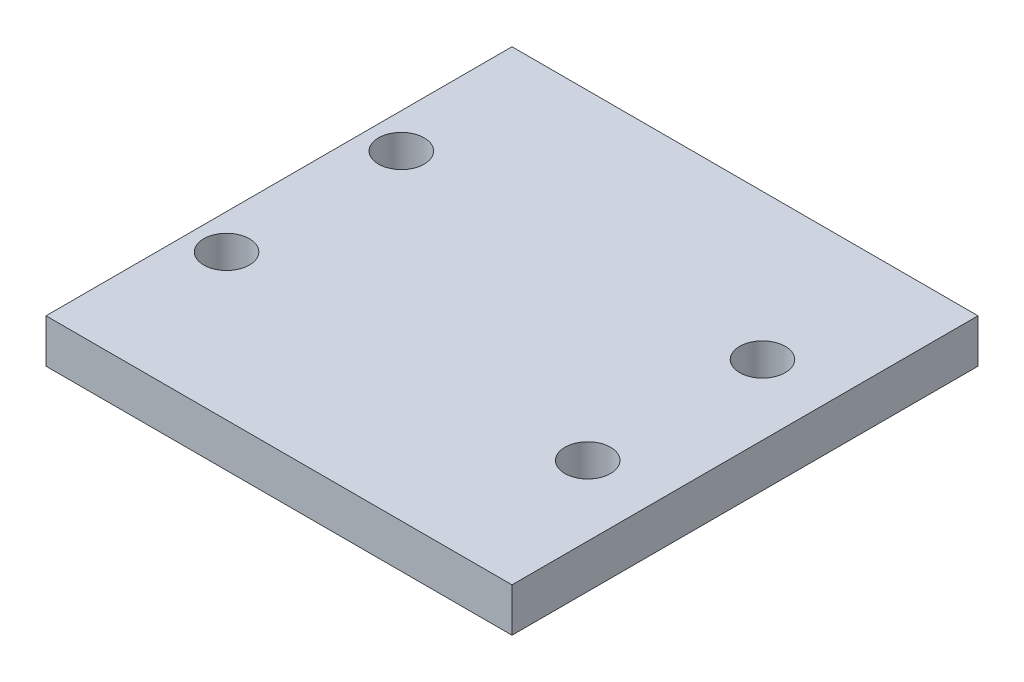
from build123d import *

# Parameters (mm, degrees)
SKETCH1_W           = 50.8
SKETCH1_H           = 50.8
BOSS_EXTRUDE1_DEPTH = 4.7625
SKETCH2_R           = 2.4892
CUT_EXTRUDE1_DEPTH  = 4.7625


with BuildPart() as part:
    # Sketch1 → Boss-Extrude1 (new body)
    with BuildSketch(Plane(origin=(0, 0, 0), x_dir=(1, 0, 0), z_dir=(0, 1, 0))):
        with Locations((25.4, 25.4)):
            Rectangle(SKETCH1_W, SKETCH1_H)
    extrude(amount=BOSS_EXTRUDE1_DEPTH)

    # Sketch2 → Cut-Extrude1 (cut)
    with BuildSketch(Plane(origin=(0, 4.7625, 0), x_dir=(1, 0, 0), z_dir=(0, 1, 0))):
        with Locations(Location((3.81, 15.875, 0), (0, 0, 270))):
            Circle(SKETCH2_R)
        with Locations(Location((43.18, 15.875, 0), (0, 0, 270))):
            Circle(SKETCH2_R)
        with Locations(Location((43.18, 34.925, 0), (0, 0, 270))):
            Circle(SKETCH2_R)
        with Locations(Location((3.81, 34.925, 0), (0, 0, 270))):
            Circle(SKETCH2_R)
    extrude(amount=-CUT_EXTRUDE1_DEPTH, mode=Mode.SUBTRACT)


solid = part.part
